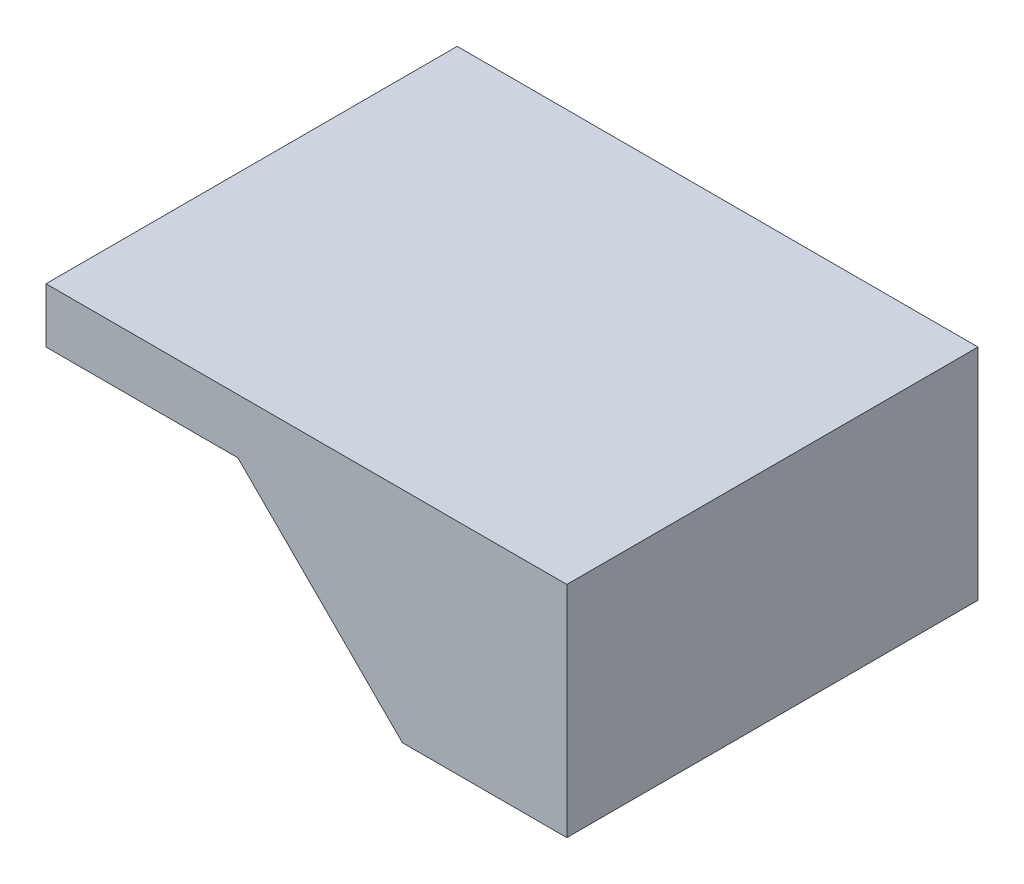
from build123d import *

# Parameters (mm, degrees)
EXTRUDE_1_DEPTH          = 75
EXTRUDE_2_REACH          = 181.652
EXTRUDE_3_DEPTH          = 150
EXTRUDE_4_DEPTH          = 14.142135624
CUT_EXTRUDE_2_DEPTH      = 267.643072547
CUT_EXTRUDE_2_DEPTH_BACK = 267.643072547
SKETCH_5_W               = 110.242252028
SKETCH_5_H               = 36.038971429
CUT_EXTRUDE_3_DEPTH      = 265.95282599
CUT_EXTRUDE_3_DEPTH_BACK = 265.95282599
SKETCH_6_W               = 40.565596645
SKETCH_6_H               = 160.869683045


with BuildPart() as part:
    # 草图1 → 凸台-拉伸1 (new, symmetric)
    with BuildSketch(Plane.XY):
        Polygon((0, 0), (70, 0), (120, -50), (210, -50), (210, 20), (0, 20), align=None)
    extrude(amount=EXTRUDE_1_DEPTH, both=True)

    # 凸台-拉伸2: up to this plane
    extrude_2_end = Plane(origin=(0, 0, 75), z_dir=(0, 1, 0))
    # 草图2 → 凸台-拉伸2 (add, up to the surface)
    with BuildSketch(Plane(origin=(85, -85, 0), x_dir=(0, 0, -1), z_dir=(-0.7071067811865562, 0.7071067811865388, 0)), mode=Mode.PRIVATE) as extrude_2_sk1:
        Polygon((5, -44.497474683), (10, -41.997474683), (10, -39.497474683), (-10, -39.497474683), (-10, -41.997474683), (-5, -44.497474683), (-5, -54.497474683), (5, -54.497474683), align=None)
    extrude_2_tool1 = split(extrude(extrude_2_sk1.sketch, amount=EXTRUDE_2_REACH, mode=Mode.PRIVATE), bisect_by=extrude_2_end, keep=Keep.BOTH, mode=Mode.PRIVATE)
    add(extrude_2_tool1.solids().sort_by_distance((117.446559, -52.553441, 0))[0])

    # 草图4 → 凸台-拉伸3 (add)
    with BuildSketch(Plane.XY.offset(75)):
        Polygon((120, -50), (130, -60), (210, -60), (210, -50), align=None)
    extrude(amount=-EXTRUDE_3_DEPTH)

    # 草图2<2> → 凸台-拉伸4 (add)
    with BuildSketch(Plane(origin=(85, -85, 0), x_dir=(0, 0, -1), z_dir=(-0.7071067811865562, 0.7071067811865388, 0))):
        Polygon((5, -44.497474683), (10, -41.997474683), (10, -39.497474683), (-10, -39.497474683), (-10, -41.997474683), (-5, -44.497474683), (-5, -54.497474683), (5, -54.497474683), align=None)
    extrude(amount=-EXTRUDE_4_DEPTH)

    # 草图5 → 切除-拉伸2 (cut, two sides: drawn at the far end of the back side and taken through both)
    with BuildSketch(Plane(origin=(0, 0, -75), x_dir=(-1, 0, 0), z_dir=(0, 0, -1)).offset(-CUT_EXTRUDE_2_DEPTH_BACK)):
        with Locations((-132.449509919, -78.019485715)):
            Rectangle(SKETCH_5_W, SKETCH_5_H)
    extrude(amount=CUT_EXTRUDE_2_DEPTH + CUT_EXTRUDE_2_DEPTH_BACK, mode=Mode.SUBTRACT)

    # 草图6 → 切除-拉伸3 (cut, two sides: drawn at the far end of the back side and taken through both)
    with BuildSketch(Plane.XY.offset(75).offset(-CUT_EXTRUDE_3_DEPTH_BACK)):
        with Locations((210.282798323, -41.689599735)):
            Rectangle(SKETCH_6_W, SKETCH_6_H)
    extrude(amount=CUT_EXTRUDE_3_DEPTH + CUT_EXTRUDE_3_DEPTH_BACK, mode=Mode.SUBTRACT)


solid = part.part
